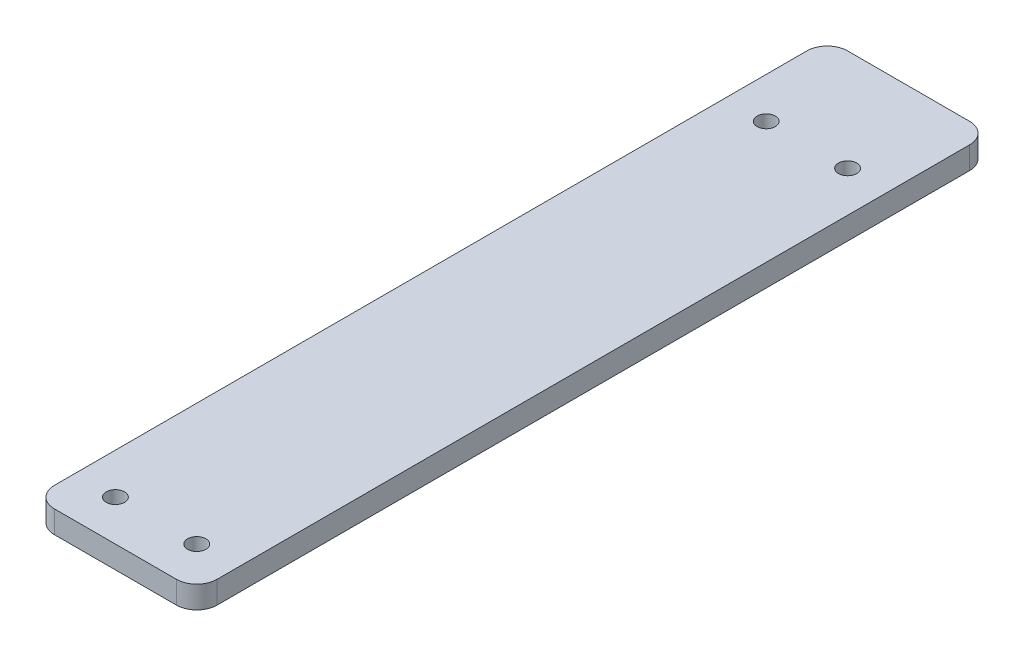
from build123d import *

# Parameters (mm, degrees)
CROQUIS1_R              = 2.25
SALIENTE_EXTRUIR1_DEPTH = 5.5


with BuildPart() as part:
    # Croquis1 → Saliente-Extruir1 (new body)
    with BuildSketch(Plane(origin=(0, 0, 0), x_dir=(1, 0, 0), z_dir=(0, 1, 0))):
        with BuildLine():
            Line((0, -5), (0, -190))
            ThreePointArc((0, -190), (-1.464466094, -193.535533906), (-5, -195))
            Line((-5, -195), (-35, -195))
            ThreePointArc((-35, -195), (-38.535533906, -193.535533906), (-40, -190))
            Line((-40, -190), (-40, -5))
            ThreePointArc((-40, -5), (-38.535533906, -1.464466094), (-35, 0))
            Line((-35, 0), (-5, 0))
            ThreePointArc((-5, 0), (-1.464466094, -1.464466094), (0, -5))
        make_face()
        with Locations(Location((-30, -25, 0), (0, 0, 270))):
            Circle(CROQUIS1_R, mode=Mode.SUBTRACT)
        with Locations(Location((-10, -25, 0), (0, 0, 270))):
            Circle(CROQUIS1_R, mode=Mode.SUBTRACT)
        with Locations(Location((-30, -185, 0), (0, 0, 270))):
            Circle(CROQUIS1_R, mode=Mode.SUBTRACT)
        with Locations(Location((-10, -185, 0), (0, 0, 270))):
            Circle(CROQUIS1_R, mode=Mode.SUBTRACT)
    extrude(amount=SALIENTE_EXTRUIR1_DEPTH)


solid = part.part
